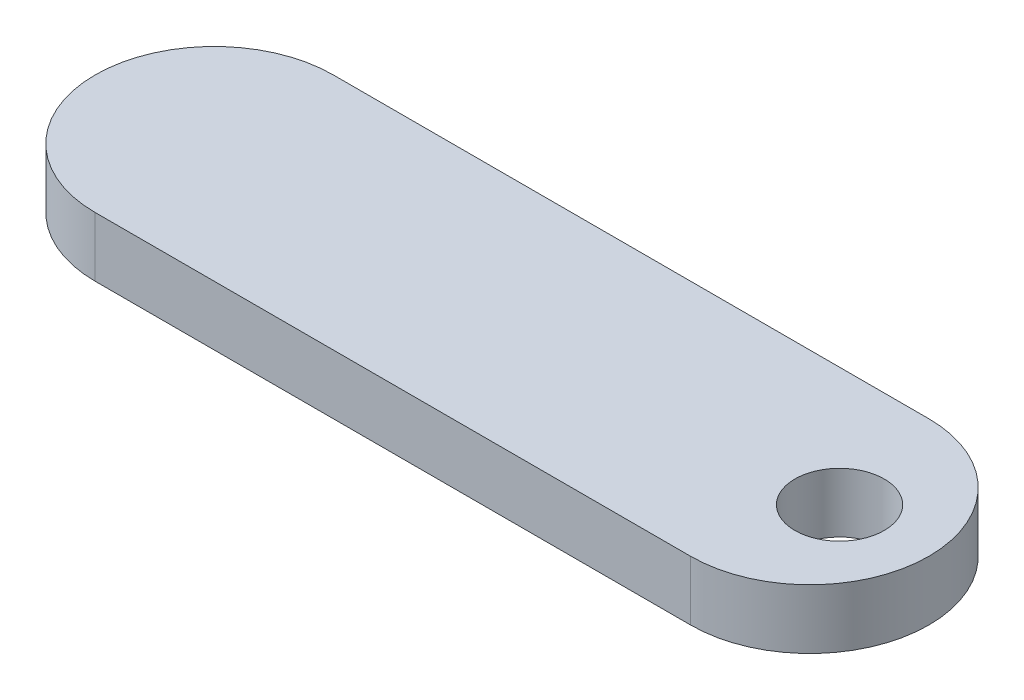
from build123d import *

# Parameters (mm, degrees)
BATON_DEPTH       = 2.54
SKETCH5_R         = 1.905
JOINER_HOLE_DEPTH = 2.54


with BuildPart() as part:
    # Sketch1 → baton (new body)
    with BuildSketch(Plane(origin=(0, 0, 0), x_dir=(1, 0, 0), z_dir=(0, 1, 0))):
        with BuildLine():
            Line((-12.7, 5.08), (12.7, 5.08))
            ThreePointArc((12.7, 5.08), (17.78, 0), (12.7, -5.08))
            Line((12.7, -5.08), (-12.7, -5.08))
            ThreePointArc((-12.7, -5.08), (-17.78, 0), (-12.7, 5.08))
        make_face()
    extrude(amount=BATON_DEPTH)

    # Sketch5 → joiner hole (cut)
    with BuildSketch(Plane(origin=(0, 2.54, 0), x_dir=(1, 0, 0), z_dir=(0, 1, 0))):
        with Locations(Location((13.97, 0, 0), (0, 0, 270))):
            Circle(SKETCH5_R)
    extrude(amount=-JOINER_HOLE_DEPTH, mode=Mode.SUBTRACT)


solid = part.part
